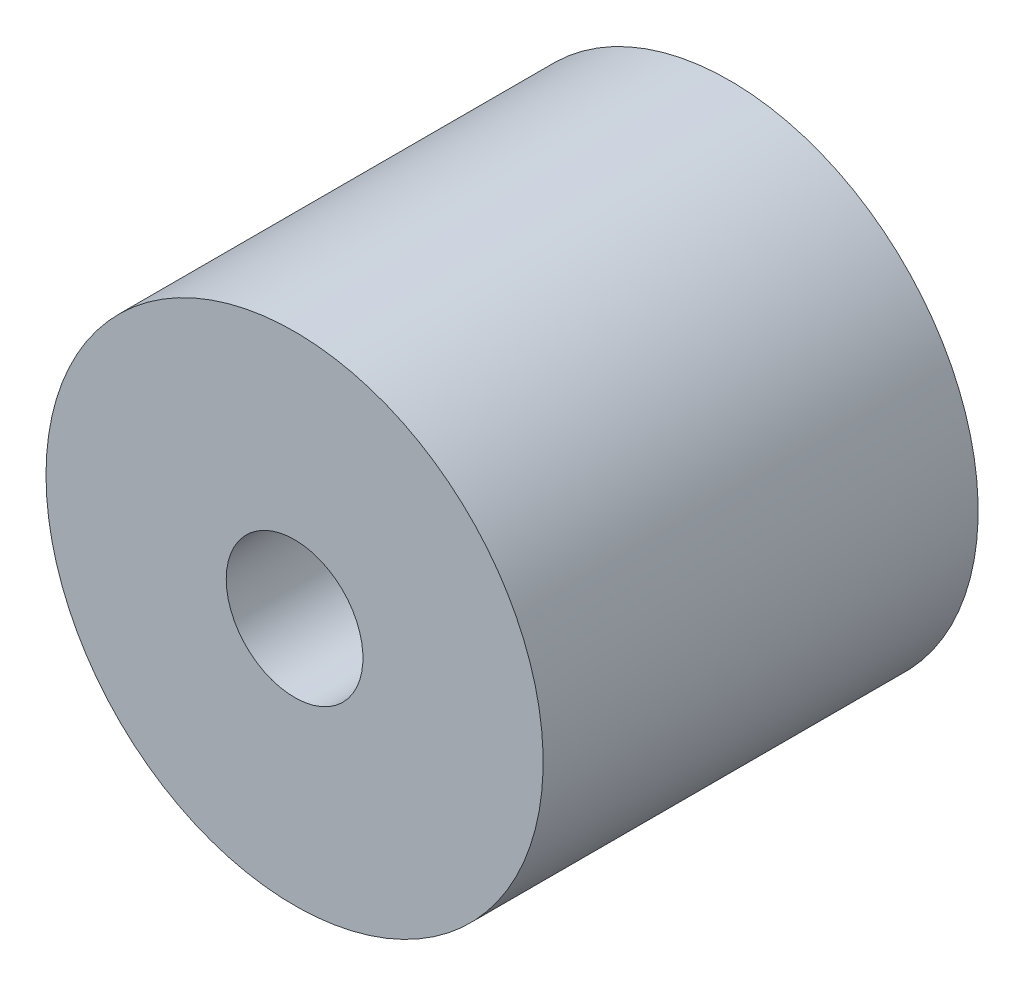
from build123d import *

# Parameters (mm, degrees)
SKETCH_1_R      = 6
SKETCH_1_R_2    = 1.65
EXTRUDE_1_DEPTH = 10.5


with BuildPart() as part:
    # 草图1 → 凸台-拉伸1 (new body)
    with BuildSketch(Plane.XY):
        with Locations(Location((0, 0, 0), (0, 0, 180))):
            Circle(SKETCH_1_R)
        with Locations(Location((0, 0, 0), (0, 0, 180))):
            Circle(SKETCH_1_R_2, mode=Mode.SUBTRACT)
    extrude(amount=EXTRUDE_1_DEPTH)


solid = part.part
